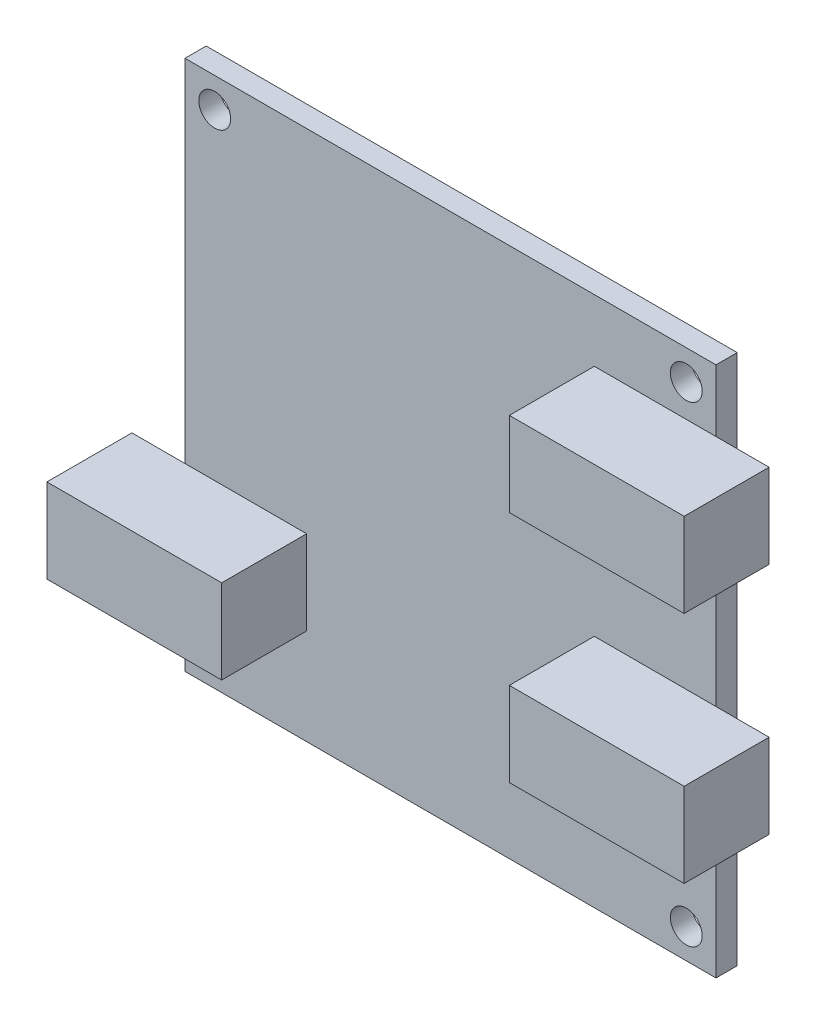
from build123d import *

# Parameters (mm, degrees)
SKIZZE1_W                         = 50
SKIZZE1_H                         = 50
AUFSATZ_LINEAR_AUSTRAGEN1_DEPTH   = 2
SKIZZE2_R                         = 1.5
SCHNITT_LINEAR_AUSTRAGEN1_DEPTH   = 2
SKIZZE3_W                         = 16.456359153
SKIZZE3_H                         = 7.92791832
AUFSATZ_LINEAR_AUSTRAGEN2_DEPTH   = 8
SKIZZE3_H_2                       = 7.927918321
AUFSATZ_LINEAR_AUSTRAGEN2_2_DEPTH = 8
AUFSATZ_LINEAR_AUSTRAGEN2_3_DEPTH = 8


with BuildPart() as part:
    # Skizze1 → Aufsatz-Linear austragen1 (new body)
    with BuildSketch(Plane(origin=(0, 0, 0), x_dir=(0, 1, 0), z_dir=(0, 0, 1))):
        Rectangle(SKIZZE1_W, SKIZZE1_H)
    extrude(amount=AUFSATZ_LINEAR_AUSTRAGEN1_DEPTH)

    # Skizze2 → Schnitt-Linear austragen1 (cut)
    with BuildSketch(Plane.XY.offset(2)):
        with Locations((22.2, 22.2)):
            Circle(SKIZZE2_R)
        with Locations((22.2, -22.2)):
            Circle(SKIZZE2_R)
        with Locations((-22.2, -22.2)):
            Circle(SKIZZE2_R)
        with Locations((-22.2, 22.2)):
            Circle(SKIZZE2_R)
    extrude(amount=-SCHNITT_LINEAR_AUSTRAGEN1_DEPTH, mode=Mode.SUBTRACT)


with BuildPart() as body_2:
    # Skizze3 → Aufsatz-Linear austragen2 (new body)
    with BuildSketch(Plane.XY.offset(2)):
        with Locations((-21.771820424, -12.009618842)):
            Rectangle(SKIZZE3_W, SKIZZE3_H)
    extrude(amount=AUFSATZ_LINEAR_AUSTRAGEN2_DEPTH)


with BuildPart() as body_3:
    # Skizze3 → Aufsatz-Linear austragen2 2 (new body)
    with BuildSketch(Plane.XY.offset(2)):
        with Locations((21.771820424, 15.188635595)):
            Rectangle(SKIZZE3_W, SKIZZE3_H_2)
    extrude(amount=AUFSATZ_LINEAR_AUSTRAGEN2_2_DEPTH)


with BuildPart() as body_4:
    # Skizze3 → Aufsatz-Linear austragen2 3 (new body)
    with BuildSketch(Plane.XY.offset(2)):
        with Locations((21.771820424, -6.82899895)):
            Rectangle(SKIZZE3_W, SKIZZE3_H_2)
    extrude(amount=AUFSATZ_LINEAR_AUSTRAGEN2_3_DEPTH)


solid = Compound([part.part, body_2.part, body_3.part, body_4.part])
